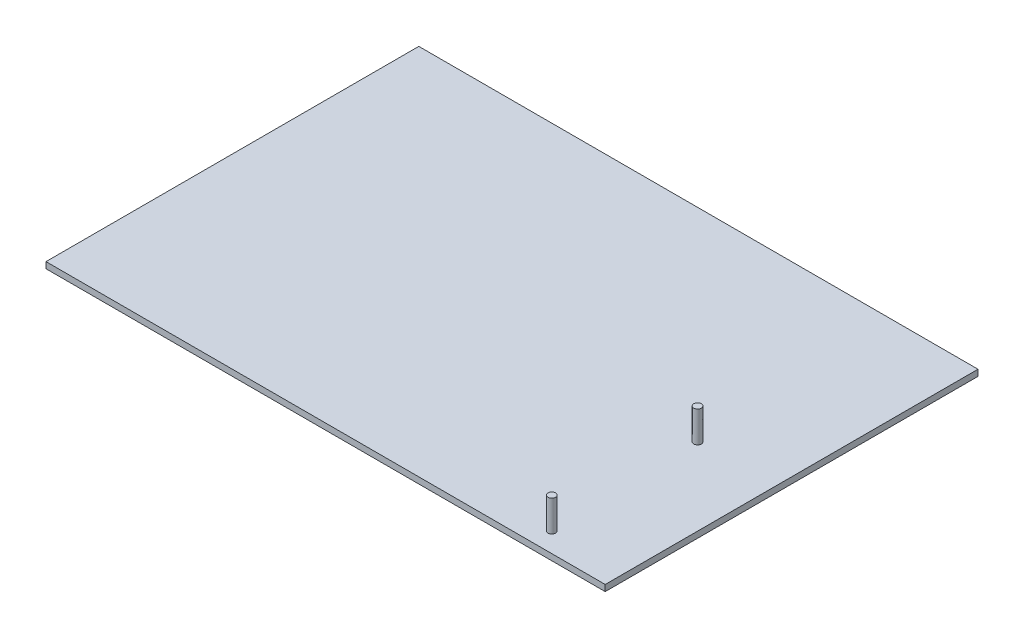
from build123d import *

# Parameters (mm, degrees)
IZIM2_W                     = 180
IZIM2_H                     = 120
Y_KSEKLIK_EKSTR_ZYON1_DEPTH = 2
IZIM3_R                     = 1.225
Y_KSEKLIK_EKSTR_ZYON2_DEPTH = 10


with BuildPart() as part:
    # Çizim2 → Yükseklik-Ekstrüzyon1 (new body)
    with BuildSketch(Plane(origin=(0, 0, 0), x_dir=(1, 0, 0), z_dir=(0, 1, 0))):
        Rectangle(IZIM2_W, IZIM2_H)
    extrude(amount=Y_KSEKLIK_EKSTR_ZYON1_DEPTH)

    # Çizim3 → Yükseklik-Ekstrüzyon2 (add)
    with BuildSketch(Plane(origin=(0, 2, 0), x_dir=(1, 0, 0), z_dir=(0, 1, 0))):
        with Locations(Location((66.5, -53.67, 0), (0, 0, 90))):
            Circle(IZIM3_R)
        with Locations(Location((65.1, -5.37, 0), (0, 0, 90))):
            Circle(IZIM3_R)
    extrude(amount=Y_KSEKLIK_EKSTR_ZYON2_DEPTH)


solid = part.part
